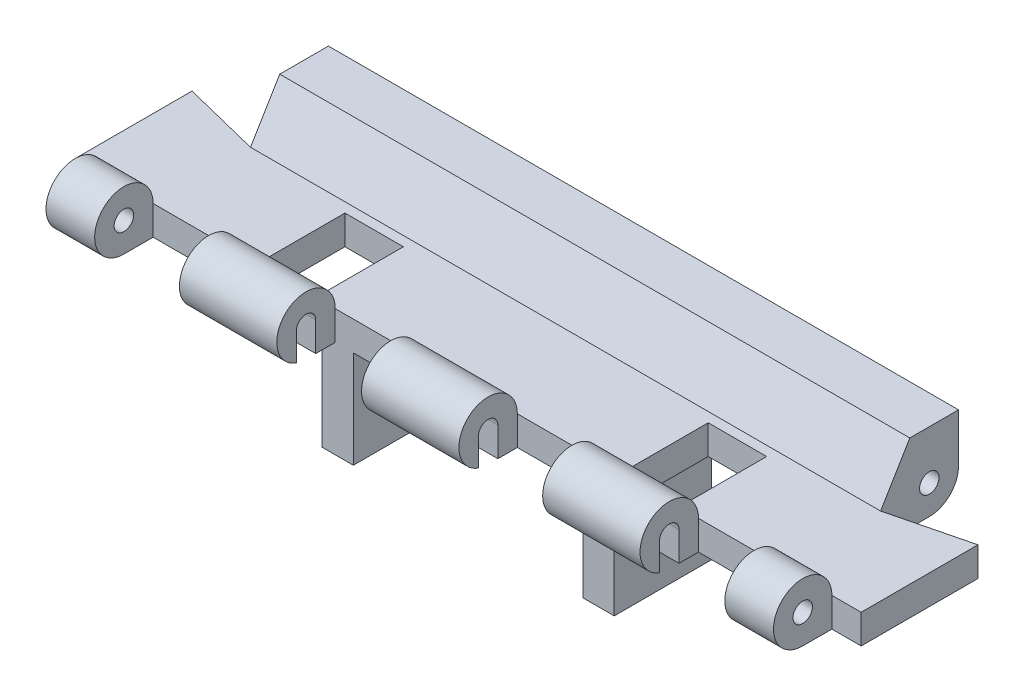
from build123d import *

# Parameters (mm, degrees)
SKETCH3_R               = 0.5
BOSS_EXTRUDE2_DEPTH     = 40.35
SKETCH4_W               = 12.68
SKETCH4_H               = 5
SKETCH4_W_2             = 11.795
SKETCH4_W_3             = 12.675
CUT_EXTRUDE1_DEPTH      = 40.35
CUT_EXTRUDE2_DEPTH      = 43.197422907
CUT_EXTRUDE2_DEPTH_BACK = 43.197422907
SKETCH5_W               = 1.5
SKETCH5_H               = 3
SKETCH5_W_2             = 4.35
SKETCH5_W_3             = 4.3
CUT_EXTRUDE3_REACH      = 40.39
CUT_EXTRUDE5_DEPTH      = 42.992529097
CUT_EXTRUDE5_DEPTH_BACK = 42.992529097
SKETCH10_W              = 6.518300251
SKETCH10_H              = 2.5
SKETCH10_W_2            = 4.701644982
SKETCH10_H_2            = 2.273607068
CUT_EXTRUDE6_DEPTH      = 2.5
SKETCH12_W              = 5
SKETCH12_H              = 3
CUT_EXTRUDE7_DEPTH      = 3
CUT_EXTRUDE8_DEPTH      = 3
FILLET1_R               = 1


with BuildPart() as part:
    # Sketch3 → Boss-Extrude2 (new body)
    with BuildSketch(Plane(origin=(0, 0, 0), x_dir=(0, 0, -1), z_dir=(1, 0, 0))):
        with BuildLine():
            Line((-9, -1.5), (-7.5, -1.5))
            Line((-7.5, -1.5), (-7.5, -6.5))
            Line((-7.5, -6.5), (-2.5, -6.5))
            Line((-2.5, -6.5), (-2.5, -1.5))
            Line((-2.5, -1.5), (0, -1.5))
            ThreePointArc((0, -1.5), (1.060660172, -1.060660172), (1.5, 0))
            Line((1.5, 0), (1.5, 2.5))
            Line((1.5, 2.5), (-1, 2.5))
            Line((-1, 2.5), (-2.5, 0))
            Line((-2.5, 0), (-7.5, 0))
            ThreePointArc((-7.5, 0), (-10.060660172, 1.060660172), (-9, -1.5))
        make_face()
        Circle(SKETCH3_R, mode=Mode.SUBTRACT)
        with Locations((-9, 0)):
            Circle(SKETCH3_R, mode=Mode.SUBTRACT)
    extrude(amount=BOSS_EXTRUDE2_DEPTH)

    # Sketch4 → Cut-Extrude1 (cut)
    with BuildSketch(Plane.XY.offset(7.5)):
        with Locations((6.34, -4)):
            Rectangle(SKETCH4_W, SKETCH4_H)
        with Locations((20.1775, -4)):
            Rectangle(SKETCH4_W_2, SKETCH4_H)
        with Locations((34.0125, -4)):
            Rectangle(SKETCH4_W_3, SKETCH4_H)
    extrude(amount=-CUT_EXTRUDE1_DEPTH, mode=Mode.SUBTRACT)

    # Sketch5 → Cut-Extrude2 (cut, two sides: drawn at the far end of the back side and taken through both)
    with BuildSketch(Plane(origin=(0, 0, 0), x_dir=(1, 0, 0), z_dir=(0, 1, 0)).offset(-CUT_EXTRUDE2_DEPTH_BACK)):
        with Locations((0.75, -9)):
            Rectangle(SKETCH5_W, SKETCH5_H)
        with Locations((6.175, -9)):
            Rectangle(SKETCH5_W_2, SKETCH5_H)
        with Locations((15.525, -9)):
            Rectangle(SKETCH5_W_2, SKETCH5_H)
        with Locations((39.6, -9)):
            Rectangle(SKETCH5_W, SKETCH5_H)
        with Locations((34.175, -9)):
            Rectangle(SKETCH5_W_2, SKETCH5_H)
        with Locations((24.85, -9)):
            Rectangle(SKETCH5_W_3, SKETCH5_H)
    extrude(amount=CUT_EXTRUDE2_DEPTH + CUT_EXTRUDE2_DEPTH_BACK, mode=Mode.SUBTRACT)

    # Cut-Extrude3: up to this face of the body (flat: up to its plane)
    cut_extrude3_end = Plane(part.part.faces().sort_by_distance((36.35, -0.75, 7.542426407))[0])
    # Sketch6 → Cut-Extrude3 (cut, up to the picked face)
    with BuildSketch(Plane(origin=(4, 0, 0), x_dir=(0, 0, -1), z_dir=(1, 0, 0)), mode=Mode.PRIVATE) as cut_extrude3_sk1:
        with BuildLine():
            Line((-9.5, 0), (-9.5, -1.414213562))
            Line((-9.5, -1.414213562), (-9.5, -1.862718476))
            Line((-9.5, -1.862718476), (-8.5, -1.862718476))
            Line((-8.5, -1.862718476), (-8.5, 0))
            ThreePointArc((-8.5, 0), (-9, 0.5), (-9.5, 0))
        make_face()
    cut_extrude3_tool1 = split(extrude(cut_extrude3_sk1.sketch, amount=CUT_EXTRUDE3_REACH, mode=Mode.PRIVATE), bisect_by=cut_extrude3_end, keep=Keep.BOTH, mode=Mode.PRIVATE)
    add(cut_extrude3_tool1.solids().sort_by(Axis((4, -0.732249, 9), (1, 0, 0)))[0], mode=Mode.SUBTRACT)

    # Sketch9 → Cut-Extrude5 (cut, two sides: drawn at the far end of the back side and taken through both)
    with BuildSketch(Plane.XZ.offset(1.5).offset(-CUT_EXTRUDE5_DEPTH_BACK)):
        Polygon((0, -1.5), (0, 1.5), (4, 2.5), (4, -1.5), align=None)
        Polygon((40.35, -1.5), (36.35, -1.5), (36.35, 2.5), (40.35, 1.5), align=None)
    extrude(amount=CUT_EXTRUDE5_DEPTH + CUT_EXTRUDE5_DEPTH_BACK, mode=Mode.SUBTRACT)

    # Sketch10 → Cut-Extrude6 (cut)
    with BuildSketch(Plane(origin=(0, 0, 0), x_dir=(1, 0, 0), z_dir=(0, 1, 0))):
        with Locations((0.740849874, -1.25)):
            Rectangle(SKETCH10_W, SKETCH10_H)
        with Locations((38.700822491, -1.363196466)):
            Rectangle(SKETCH10_W_2, SKETCH10_H_2)
    extrude(amount=CUT_EXTRUDE6_DEPTH, mode=Mode.SUBTRACT)

    # Sketch12 → Cut-Extrude7 (cut)
    with BuildSketch(Plane.XZ.offset(1.5)):
        with Locations((10.85, 0)):
            Rectangle(SKETCH12_W, SKETCH12_H)
        with Locations((20.2, 0)):
            Rectangle(SKETCH12_W, SKETCH12_H)
        with Locations((29.5, 0)):
            Rectangle(SKETCH12_W, SKETCH12_H)
    extrude(amount=-CUT_EXTRUDE7_DEPTH, mode=Mode.SUBTRACT)

    # Sketch7 → Cut-Extrude8 (cut)
    with BuildSketch(Plane(origin=(0, 0, 0), x_dir=(1, 0, 0), z_dir=(0, 1, 0))):
        Polygon((12.35, -6.5), (12.35, -7), (9.35, -7), (9.35, -6.5), (9.35, -3.5), (9.35, -3), (12.35, -3), (12.35, -3.5), align=None)
        Polygon((31, -6.5), (31, -7), (28, -7), (28, -6.5), (28, -3.5), (28, -3), (31, -3), (31, -3.5), align=None)
    extrude(amount=-CUT_EXTRUDE8_DEPTH, mode=Mode.SUBTRACT)

    # Fillet1
    fillet1_edges = [part.edges().sort_by_distance(p)[0] for p in [
        (10.85, 1.5, 1.5),
        (20.2, 1.5, 1.5),
        (29.5, 1.5, 1.5),
    ]]
    fillet(fillet1_edges, radius=FILLET1_R)


solid = part.part
